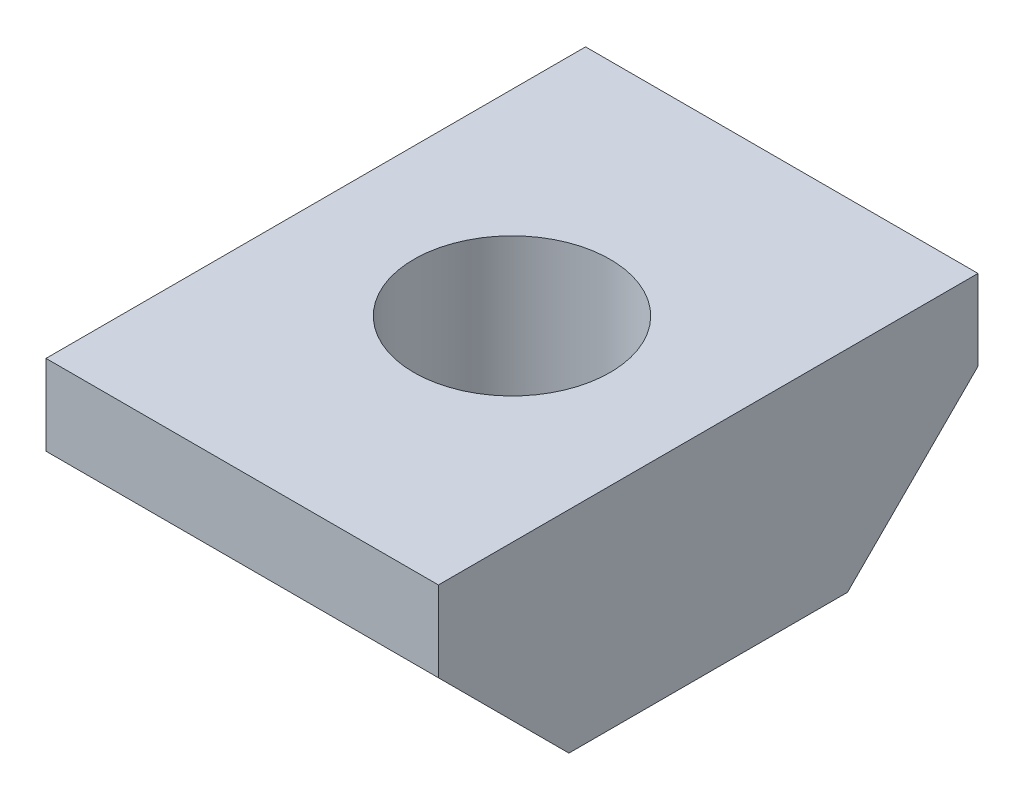
from build123d import *

# Parameters (mm, degrees)
BOSS_EXTRUDE1_DEPTH = 8
SKETCH7_R           = 2
CUT_EXTRUDE1_DEPTH  = 4.3


with BuildPart() as part:
    # Sketch1 → Boss-Extrude1 (new body)
    with BuildSketch(Plane(origin=(0, 0, 0), x_dir=(0, 0, -1), z_dir=(1, 0, 0))):
        Polygon((-2.839339828, -4.3), (2.839339828, -4.3), (5.5, -1.639339828), (5.5, 0), (-5.5, 0), (-5.5, -1.639339828), align=None)
    extrude(amount=BOSS_EXTRUDE1_DEPTH)

    # Sketch7 → Cut-Extrude1 (cut)
    with BuildSketch(Plane(origin=(0, 0, 0), x_dir=(1, 0, 0), z_dir=(0, 1, 0))):
        with Locations(Location((4, 0, 0), (0, 0, 270))):
            Circle(SKETCH7_R)
    extrude(amount=-CUT_EXTRUDE1_DEPTH, mode=Mode.SUBTRACT)


solid = part.part
